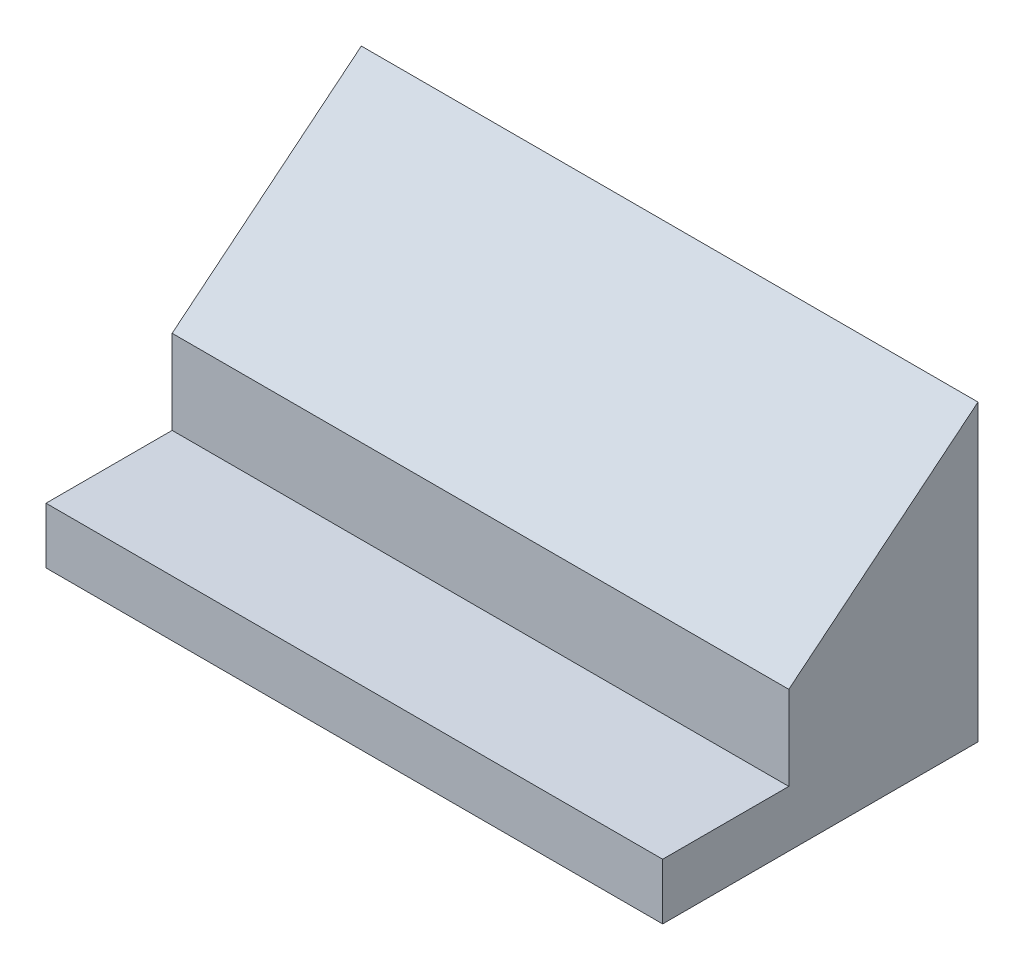
from build123d import *

# Parameters (mm, degrees)
BOSS_EXTRUDE1_DEPTH = 8.8


with BuildPart() as part:
    # Sketch2 → Boss-Extrude1 (new body)
    with BuildSketch(Plane(origin=(0, 0, 0), x_dir=(0, 0, -1), z_dir=(1, 0, 0))):
        Polygon((0, 0), (4.5, 0), (4.5, 4.2), (1.8, 2), (1.8, 0.8), (0, 0.8), align=None)
    extrude(amount=BOSS_EXTRUDE1_DEPTH)


solid = part.part
